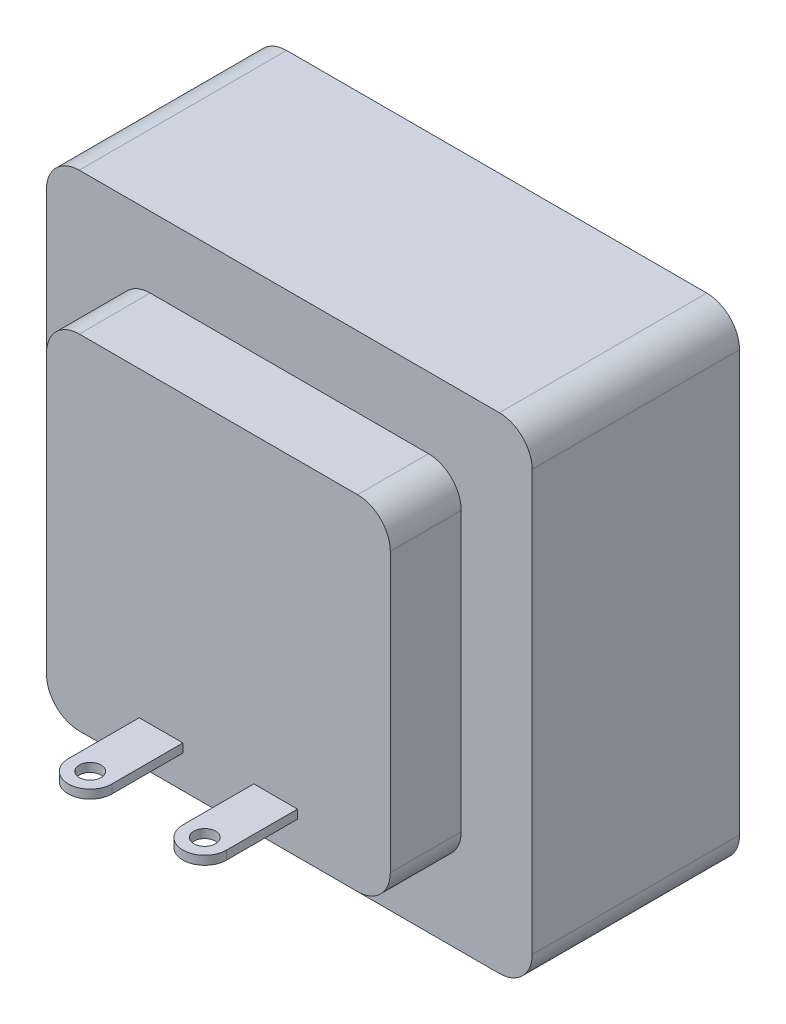
from build123d import *

# Parameters (mm, degrees)
SKETCH1_W           = 44.5
SKETCH1_H           = 44.5
BASE_EXTRUDE_DEPTH  = 9.5
BOSS_EXTRUDE1_START = -15.75
SKETCH2_W           = 32
SKETCH2_H           = 31.5
BOSS_EXTRUDE1_DEPTH = 31.5
FILLET1_R           = 3
SKETCH3_W           = 4
SKETCH3_H           = 0.8
BOSS_EXTRUDE2_DEPTH = 6.5
BOSS_EXTRUDE3_DEPTH = 0.8
SKETCH5_R           = 1
CUT_EXTRUDE1_DEPTH  = 48.591517101


with BuildPart() as part:
    # Sketch1 → Base-Extrude (new, symmetric)
    with BuildSketch(Plane.XY):
        Rectangle(SKETCH1_W, SKETCH1_H)
    extrude(amount=BASE_EXTRUDE_DEPTH, both=True)

    # Sketch2 → Boss-Extrude1 (add)
    with BuildSketch(Plane(origin=(0, 0, 0), x_dir=(0, 0, -1), z_dir=(1, 0, 0)).offset(BOSS_EXTRUDE1_START)):
        Rectangle(SKETCH2_W, SKETCH2_H)
    extrude(amount=BOSS_EXTRUDE1_DEPTH)

    # Fillet1
    fillet1_edges = [part.edges().sort_by_distance(p)[0] for p in [
        (15.75, 15.75, -12.75),
        (15.75, -15.75, -12.75),
        (-15.75, -15.75, -12.75),
        (-15.75, 15.75, -12.75),
        (15.75, 15.75, 12.75),
        (15.75, -15.75, 12.75),
        (-15.75, -15.75, 12.75),
        (-15.75, 15.75, 12.75),
        (-22.25, 22.25, 0),
        (22.25, 22.25, 0),
        (22.25, -22.25, 0),
        (-22.25, -22.25, 0),
    ]]
    fillet(fillet1_edges, radius=FILLET1_R)

    # Sketch3 → Boss-Extrude2 (add)
    with BuildSketch(Plane.XY.offset(16)):
        with Locations((-5.25, -12.35)):
            Rectangle(SKETCH3_W, SKETCH3_H)
        with Locations((5.25, -12.35)):
            Rectangle(SKETCH3_W, SKETCH3_H)
    extrude(amount=BOSS_EXTRUDE2_DEPTH)

    # Sketch4 → Boss-Extrude3 (add)
    with BuildSketch(Plane(origin=(0, -11.95, 0), x_dir=(-1, 0, 0), z_dir=(0, 1, 0))):
        with BuildLine():
            Line((-7.25, 22.5), (-3.25, 22.5))
            ThreePointArc((-3.25, 22.5), (-5.25, 24.5), (-7.25, 22.5))
        make_face()
        with BuildLine():
            Line((3.25, 22.5), (7.25, 22.5))
            ThreePointArc((7.25, 22.5), (5.25, 24.5), (3.25, 22.5))
        make_face()
    extrude(amount=-BOSS_EXTRUDE3_DEPTH)

    # Sketch5 → Cut-Extrude1 (cut, through all)
    with BuildSketch(Plane(origin=(0, -11.95, 0), x_dir=(-1, 0, 0), z_dir=(0, 1, 0))):
        with Locations(Location((5.25, 22.5, 0), (0, 0, 90))):
            Circle(SKETCH5_R)
        with Locations(Location((-5.25, 22.5, 0), (0, 0, 90))):
            Circle(SKETCH5_R)
    extrude(amount=-CUT_EXTRUDE1_DEPTH, mode=Mode.SUBTRACT)


solid = part.part
